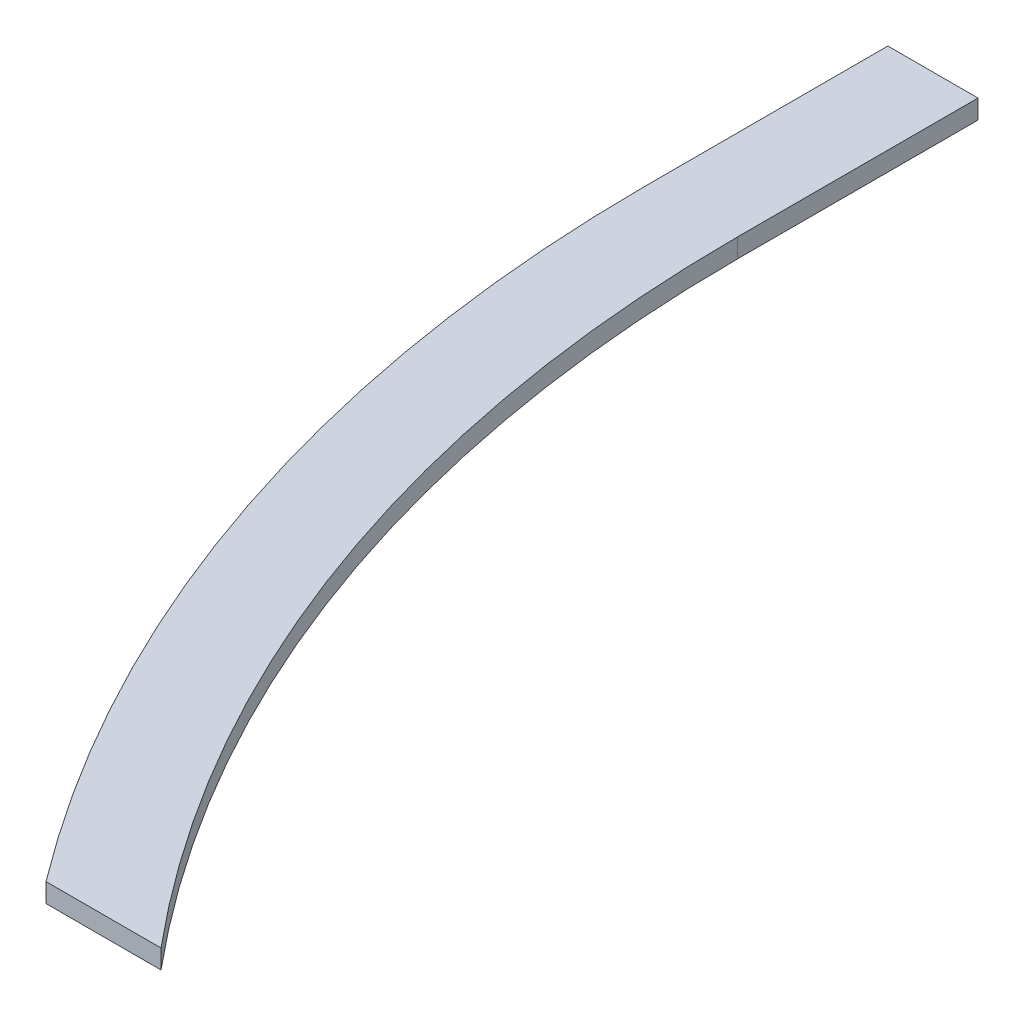
from build123d import *

# Parameters (mm, degrees)
BOSS_EXTRUDE1_DEPTH = 6.35
SKETCH3_W           = 30
SKETCH3_H           = 6.35
BOSS_EXTRUDE2_DEPTH = 80


with BuildPart() as part:
    # Sketch2 → Boss-Extrude1 (new body)
    with BuildSketch(Plane(origin=(0, 0, 0), x_dir=(1, 0, 0), z_dir=(0, 1, 0))):
        with BuildLine():
            ThreePointArc((0, -470), (-332.340187158, -332.340187158), (-470, 0))
            Line((-470, 0), (-500, 0))
            ThreePointArc((-500, 0), (-353.553390593, -353.553390593), (0, -500))
            Line((0, -500), (0, -470))
        make_face()
    extrude(amount=BOSS_EXTRUDE1_DEPTH)

    # Sketch3 → Boss-Extrude2 (add)
    with BuildSketch(Plane(origin=(0, 0, 0), x_dir=(-1, 0, 0), z_dir=(0, 0, -1))):
        with Locations((485, 3.175)):
            Rectangle(SKETCH3_W, SKETCH3_H)
    extrude(amount=BOSS_EXTRUDE2_DEPTH)

    # Split1
    split(bisect_by=Plane(origin=(0, 0, 301), x_dir=(-1, 0, 0), z_dir=(0, 0, -1)), keep=Keep.TOP)


solid = part.part
